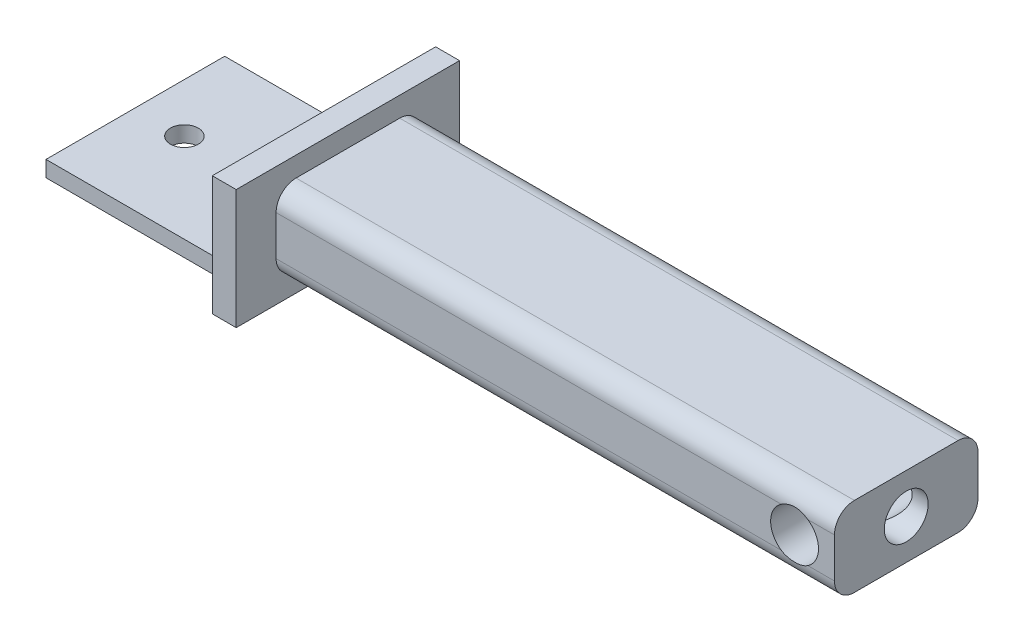
from build123d import *

# Parameters (mm, degrees)
SCHIZZO1_W                   = 70
SCHIZZO1_H                   = 18
ESTRUSIONE_ESTRUSIONE1_DEPTH = 10
RACCORDO1_R                  = 2.5
RACCORDO2_R                  = 2.5
RACCORDO3_R                  = 2.5
RACCORDO4_R                  = 2.5
FORO_PER_VITE_5_16_3_D       = 5.999999938
SCHIZZO6_W                   = 28
SCHIZZO6_H                   = 15
ESTRUSIONE_ESTRUSIONE2_DEPTH = 3
FORO_PER_VITE_M4_1_D         = 5.5
SCHIZZO12_W                  = 22.4
SCHIZZO12_H                  = 2
ESTRUSIONE_ESTRUSIONE3_DEPTH = 23.65
SCHIZZO13_R                  = 1.75
TAGLIO_ESTRUSIONE1_DEPTH     = 23.75


with BuildPart() as part:
    # Schizzo1 → Estrusione-Estrusione1 (new body)
    with BuildSketch(Plane(origin=(0, 0, 0), x_dir=(1, 0, 0), z_dir=(0, 1, 0))):
        Rectangle(SCHIZZO1_W, SCHIZZO1_H)
    extrude(amount=ESTRUSIONE_ESTRUSIONE1_DEPTH)

    # Raccordo1
    raccordo1_edges = [part.edges().sort_by_distance(p)[0] for p in [
        (0, 10, -9),
    ]]
    fillet(raccordo1_edges, radius=RACCORDO1_R)

    # Raccordo2
    raccordo2_edges = [part.edges().sort_by_distance(p)[0] for p in [
        (0, 10, 9),
    ]]
    fillet(raccordo2_edges, radius=RACCORDO2_R)

    # Raccordo3
    raccordo3_edges = [part.edges().sort_by_distance(p)[0] for p in [
        (0, 0, -9),
    ]]
    fillet(raccordo3_edges, radius=RACCORDO3_R)

    # Raccordo4
    raccordo4_edges = [part.edges().sort_by_distance(p)[0] for p in [
        (0, 0, 9),
    ]]
    fillet(raccordo4_edges, radius=RACCORDO4_R)

    # Foro per Vite 5/16-3 (through all)
    with Locations(Plane(origin=(30, 5, -9), x_dir=(-1, 0, 0), z_dir=(0, 0, -1))):
        with Locations((0, 0)):
            Hole(FORO_PER_VITE_5_16_3_D / 2)

    # Schizzo6 → Estrusione-Estrusione2 (add)
    with BuildSketch(Plane.ZY.offset(35)):
        with Locations((0, 5)):
            Rectangle(SCHIZZO6_W, SCHIZZO6_H)
    extrude(amount=ESTRUSIONE_ESTRUSIONE2_DEPTH)

    # Foro per Vite M4-1 (through all)
    with Locations(Plane.ZY.offset(38)):
        with Locations((0, 5)):
            Hole(FORO_PER_VITE_M4_1_D / 2)

    # Schizzo12 → Estrusione-Estrusione3 (add)
    with BuildSketch(Plane.ZY.offset(38)):
        with Locations((0, 0.05)):
            Rectangle(SCHIZZO12_W, SCHIZZO12_H)
    extrude(amount=ESTRUSIONE_ESTRUSIONE3_DEPTH)

    # Schizzo13 → Taglio-Estrusione1 (cut)
    with BuildSketch(Plane.XZ.offset(0.95)):
        with Locations(Location((-55.5, 0, 0), (0, 0, 270))):
            Circle(SCHIZZO13_R)
    extrude(amount=-TAGLIO_ESTRUSIONE1_DEPTH, mode=Mode.SUBTRACT)


solid = part.part
